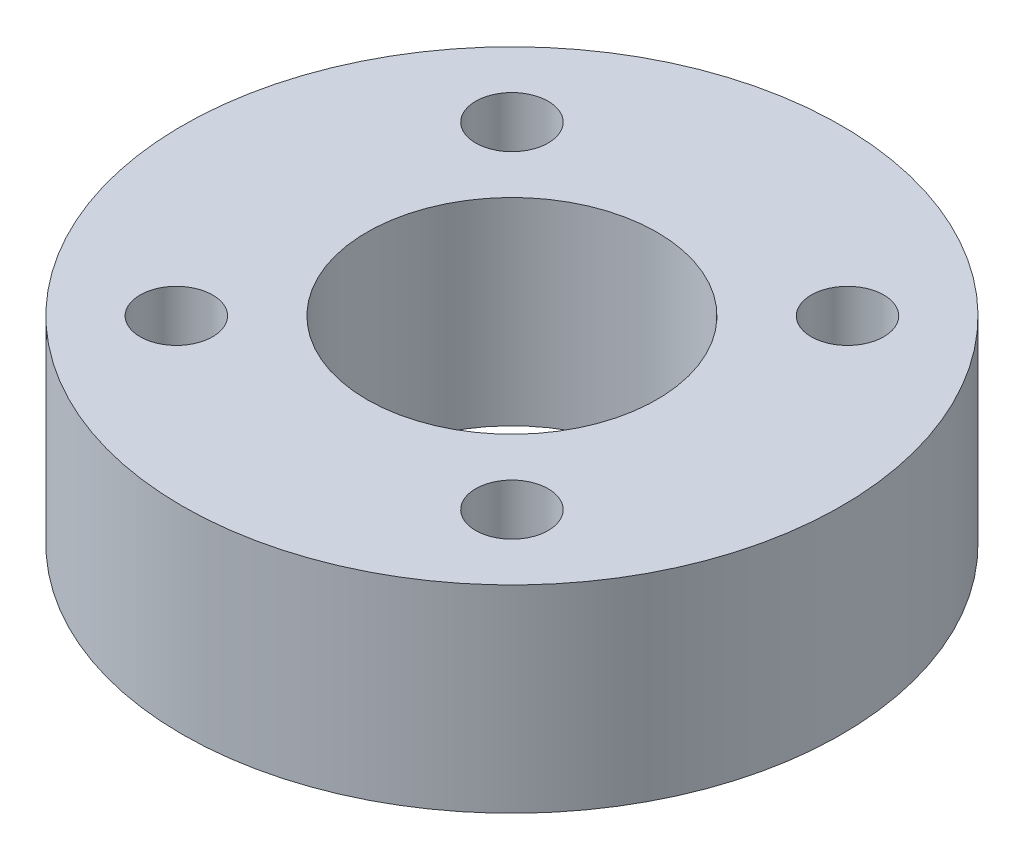
from build123d import *

# Parameters (mm, degrees)
SKETCH_1_R          = 25
EXTRUDE_1_DEPTH     = 15
SKETCH_2_R          = 11
CUT_EXTRUDE_1_DEPTH = 39.405728739
HOLE_WIZARD_M5_1_D  = 5.5


with BuildPart() as part:
    # ｽｹｯﾁ1 → ﾎﾞｽ - 押し出し1 (new body)
    with BuildSketch(Plane(origin=(0, 0, 0), x_dir=(1, 0, 0), z_dir=(0, 1, 0))):
        with Locations(Location((0, 0, 0), (0, 0, 270))):
            Circle(SKETCH_1_R)
    extrude(amount=EXTRUDE_1_DEPTH)

    # ｽｹｯﾁ2 → ｶｯﾄ - 押し出し1 (cut, through all)
    with BuildSketch(Plane(origin=(0, 15, 0), x_dir=(1, 0, 0), z_dir=(0, 1, 0))):
        with Locations(Location((0, 0, 0), (0, 0, 270))):
            Circle(SKETCH_2_R)
    extrude(amount=-CUT_EXTRUDE_1_DEPTH, mode=Mode.SUBTRACT)

    # M5 すきま穴1 (through all)
    with Locations(Plane(origin=(0, 15, 0), x_dir=(1, 0, 0), z_dir=(0, 1, 0))):
        with Locations((-12.727922061, 12.727922061), (12.727922061, -12.727922061), (-12.727922061, -12.727922061), (12.727922061, 12.727922061)):
            Hole(HOLE_WIZARD_M5_1_D / 2)


solid = part.part
